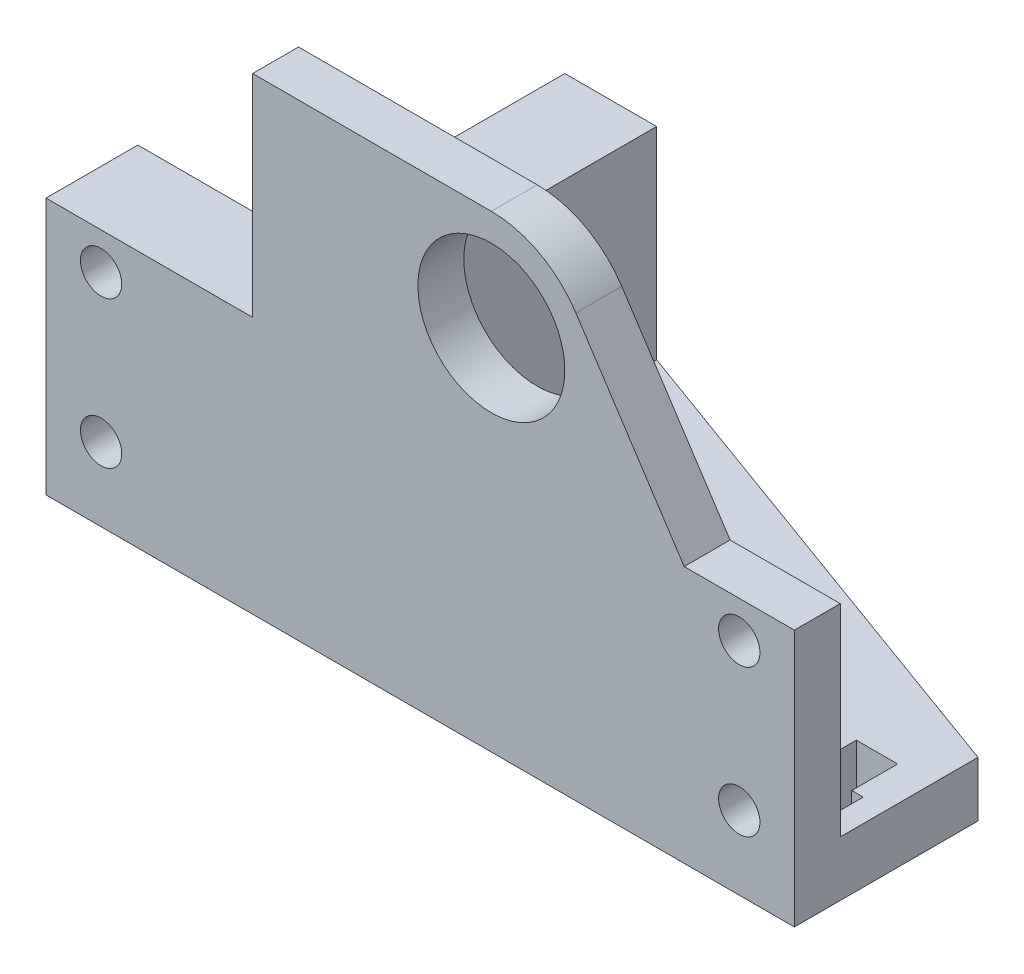
from build123d import *

# Parameters (mm, degrees)
BOSS_EXTRUDE1_DEPTH = 28
SKETCH3_W           = 43
SKETCH3_H           = 5
BOSS_EXTRUDE2_DEPTH = 51
SKETCH4_R           = 8
CUT_EXTRUDE1_DEPTH  = 82.455509329
BOSS_EXTRUDE3_DEPTH = 12
BOSS_EXTRUDE4_DEPTH = 12
SKETCH5_R           = 2.25
CUT_EXTRUDE2_DEPTH  = 96.551033485
SKETCH8_W           = 55
SKETCH8_H           = 35
BOSS_EXTRUDE5_DEPTH = 6
CUT_EXTRUDE3_DEPTH  = 85.557672626
BOSS_EXTRUDE6_DEPTH = 4
SKETCH11_R          = 2.25
CUT_EXTRUDE4_DEPTH  = 81.783661714
CUT_EXTRUDE5_REACH  = 86.558
SKETCH12_R          = 2.25
CUT_EXTRUDE6_DEPTH  = 85.557672626
CUT_EXTRUDE7_DEPTH  = 92.793245939
SKETCH15_W          = 8
SKETCH15_H          = 28
CUT_EXTRUDE8_DEPTH  = 101.713703139


with BuildPart() as part:
    # Sketch2 → Boss-Extrude1 (new body)
    with BuildSketch(Plane(origin=(0, 0, 0), x_dir=(1, 0, 0), z_dir=(0, 1, 0))):
        Polygon((-16.5, 0), (0, 0), (0, 30), (10, 30), (10, -10), (-16.5, -10), align=None)
    extrude(amount=BOSS_EXTRUDE1_DEPTH)

    # Sketch3 → Boss-Extrude2 (add)
    with BuildSketch(Plane(origin=(0, 0, 0), x_dir=(1, 0, 0), z_dir=(0, 1, 0))):
        with Locations((31.5, -7.5)):
            Rectangle(SKETCH3_W, SKETCH3_H)
    extrude(amount=BOSS_EXTRUDE2_DEPTH)

    # Sketch4 → Cut-Extrude1 (cut, through all)
    with BuildSketch(Plane(origin=(0, 0, 5), x_dir=(-1, 0, 0), z_dir=(0, 0, -1))):
        with Locations((-32, 40)):
            Circle(SKETCH4_R)
    extrude(amount=-CUT_EXTRUDE1_DEPTH, mode=Mode.SUBTRACT)

    # Sketch6 → Boss-Extrude3 (add)
    with BuildSketch(Plane.ZY.offset(16.5)):
        with BuildLine():
            Line((10, 28), (10, 0))
            Line((10, 0), (18, 0))
            Line((18, 0), (18, 12))
            ThreePointArc((18, 12), (14, 16), (18, 20))
            Line((18, 20), (18, 28))
            Line((18, 28), (10, 28))
        make_face()
    extrude(amount=-BOSS_EXTRUDE3_DEPTH)

    # Sketch7 → Boss-Extrude4 (add)
    with BuildSketch(Plane(origin=(53, 0, 0), x_dir=(0, 0, -1), z_dir=(1, 0, 0))):
        with BuildLine():
            Line((-18, 12), (-18, 0))
            Line((-18, 0), (-5, 0))
            Line((-5, 0), (-5, 28))
            Line((-5, 28), (-18, 28))
            Line((-18, 28), (-18, 20))
            ThreePointArc((-18, 20), (-14, 16), (-18, 12))
        make_face()
    extrude(amount=BOSS_EXTRUDE4_DEPTH)

    # Sketch5 → Cut-Extrude2 (cut, through all)
    with BuildSketch(Plane.XY.offset(18)):
        with Locations((-10.5, 24)):
            Circle(SKETCH5_R)
        with Locations((-10.5, 8)):
            Circle(SKETCH5_R)
        with Locations((59, 8)):
            Circle(SKETCH5_R)
        with Locations((59, 24)):
            Circle(SKETCH5_R)
    extrude(amount=-CUT_EXTRUDE2_DEPTH, mode=Mode.SUBTRACT)

    # Sketch8 → Boss-Extrude5 (add)
    with BuildSketch(Plane(origin=(0, 0, 0), x_dir=(1, 0, 0), z_dir=(0, 1, 0))):
        with Locations((37.5, 12.5)):
            Rectangle(SKETCH8_W, SKETCH8_H)
    extrude(amount=BOSS_EXTRUDE5_DEPTH)

    # Sketch9 → Cut-Extrude3 (cut, through all)
    with BuildSketch(Plane(origin=(0, 6, 0), x_dir=(-1, 0, 0), z_dir=(0, 1, 0))):
        Polygon((-62.5, 5), (-55.5, 5), (-55.5, 0), (-56.75, 0), (-56.75, -5), (-61.25, -5), (-61.25, 0), (-62.5, 0), align=None)
    extrude(amount=-CUT_EXTRUDE3_DEPTH, mode=Mode.SUBTRACT)

    # Sketch10 → Boss-Extrude6 (add)
    with BuildSketch(Plane.ZY.offset(-10)):
        Polygon((-30, 0), (5, 51), (10, 51), (10, 36.428571429), (10, 0), (-15, 0), align=None)
    extrude(amount=BOSS_EXTRUDE6_DEPTH)

    # Sketch11 → Cut-Extrude4 (cut, through all)
    with BuildSketch(Plane(origin=(10, 0, 0), x_dir=(0, 0, -1), z_dir=(1, 0, 0))):
        with Locations((24, 10.5)):
            Circle(SKETCH11_R)
    extrude(amount=-CUT_EXTRUDE4_DEPTH, mode=Mode.SUBTRACT)

    # Sketch12 → Cut-Extrude5 (cut, up to next)
    with BuildSketch(Plane(origin=(0, 6, 0), x_dir=(-1, 0, 0), z_dir=(0, 1, 0)), mode=Mode.PRIVATE) as cut_extrude5_sk1:
        with Locations(Location((-18, -8, 0), (0, 0, 90))):
            Circle(SKETCH12_R)
    cut_extrude5_tool1 = extrude(cut_extrude5_sk1.sketch, amount=-CUT_EXTRUDE5_REACH, mode=Mode.PRIVATE) & part.part
    # Sketch12 → Cut-Extrude5 (cut, up to next)
    with BuildSketch(Plane(origin=(0, 6, 0), x_dir=(-1, 0, 0), z_dir=(0, 1, 0)), mode=Mode.PRIVATE) as cut_extrude5_sk2:
        with Locations(Location((-38, -8, 0), (0, 0, 90))):
            Circle(SKETCH12_R)
    cut_extrude5_tool2 = extrude(cut_extrude5_sk2.sketch, amount=-CUT_EXTRUDE5_REACH, mode=Mode.PRIVATE) & part.part
    add(cut_extrude5_tool1.solids().sort_by_distance((18, 6, -8))[0], mode=Mode.SUBTRACT)
    add(cut_extrude5_tool2.solids().sort_by_distance((38, 6, -8))[0], mode=Mode.SUBTRACT)

    # Sketch13 → Cut-Extrude6 (cut, through all)
    with BuildSketch(Plane(origin=(0, 6, 0), x_dir=(-1, 0, 0), z_dir=(0, 1, 0))):
        Polygon((-10, -30), (-65, -10), (-65, -30), align=None)
    extrude(amount=-CUT_EXTRUDE6_DEPTH, mode=Mode.SUBTRACT)

    # Sketch14 → Cut-Extrude7 (cut, through all)
    with BuildSketch(Plane.XY.offset(10)):
        with BuildLine():
            Line((41.204046185, 46.02374749), (53, 28))
            Line((53, 28), (53, 51))
            Line((53, 51), (32, 51))
            ThreePointArc((32, 51), (37.23157613, 49.67629119), (41.204046185, 46.02374749))
        make_face()
    extrude(amount=-CUT_EXTRUDE7_DEPTH, mode=Mode.SUBTRACT)

    # Sketch15 → Cut-Extrude8 (cut, through all)
    with BuildSketch(Plane.ZY.offset(16.5)):
        with Locations((14, 14)):
            Rectangle(SKETCH15_W, SKETCH15_H)
    extrude(amount=-CUT_EXTRUDE8_DEPTH, mode=Mode.SUBTRACT)


solid = part.part
